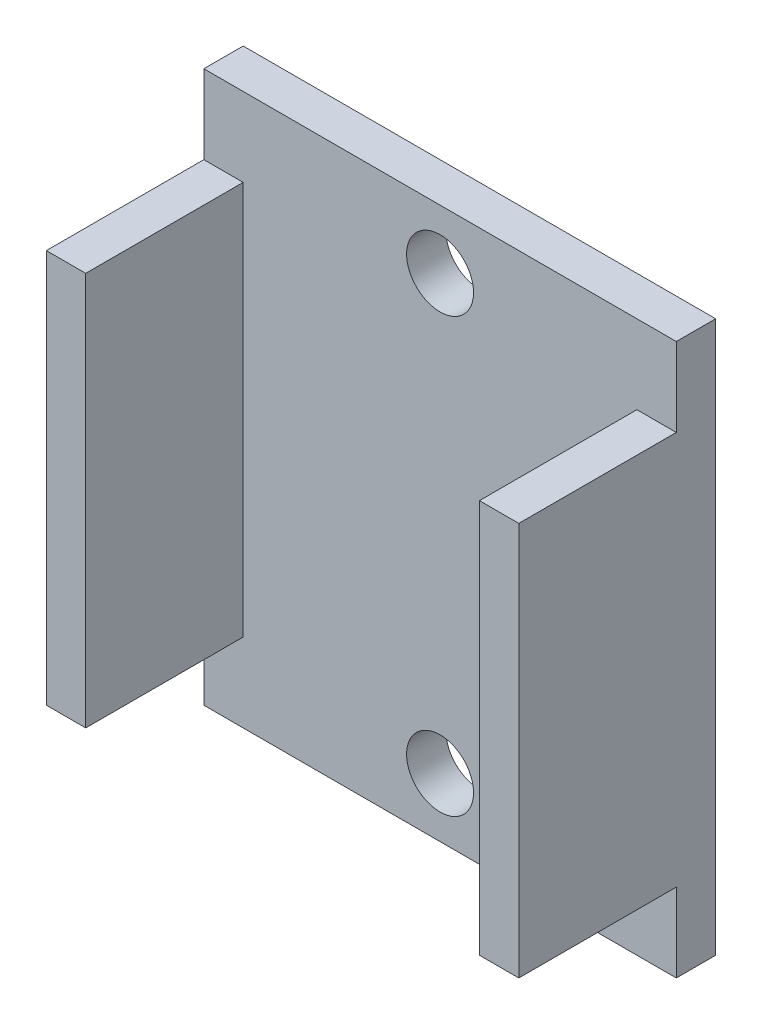
from build123d import *

# Parameters (mm, degrees)
MAIN_PROFILE_SKETCH_W     = 24
MAIN_PROFILE_SKETCH_H     = 28
MAIN_PROFILE_SKETCH_R     = 1.7
MAIN_EXTRUSION_DEPTH      = 2
DETAIL_PROFILE_2_SKETCH_W = 2
DETAIL_PROFILE_2_SKETCH_H = 20
DETAIL_EXTRUSION_2_DEPTH  = 8


with BuildPart() as part:
    # Main Profile Sketch → Main Extrusion (new body)
    with BuildSketch(Plane.XY.offset(88)):
        with Locations((-190, 0)):
            Rectangle(MAIN_PROFILE_SKETCH_W, MAIN_PROFILE_SKETCH_H)
        with Locations((-190, -11)):
            Circle(MAIN_PROFILE_SKETCH_R, mode=Mode.SUBTRACT)
        with Locations((-190, 11)):
            Circle(MAIN_PROFILE_SKETCH_R, mode=Mode.SUBTRACT)
    extrude(amount=MAIN_EXTRUSION_DEPTH)

    # Detail Profile 2 Sketch → Detail Extrusion 2 (add)
    with BuildSketch(Plane.XY.offset(90)):
        with Locations((-179, 0)):
            Rectangle(DETAIL_PROFILE_2_SKETCH_W, DETAIL_PROFILE_2_SKETCH_H)
        with Locations((-201, 0)):
            Rectangle(DETAIL_PROFILE_2_SKETCH_W, DETAIL_PROFILE_2_SKETCH_H)
    extrude(amount=DETAIL_EXTRUSION_2_DEPTH)


solid = part.part
